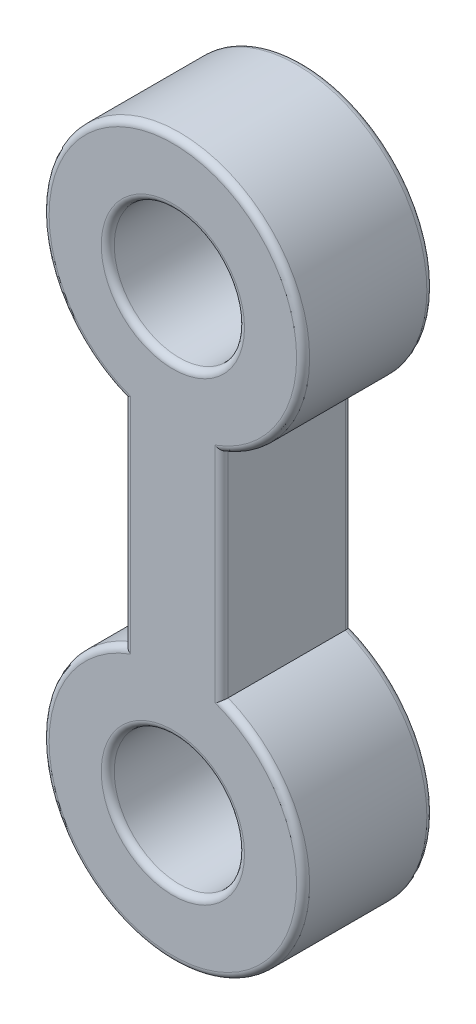
from build123d import *

# Parameters (mm, degrees)
SKETCH1_R           = 10
BOSS_EXTRUDE1_DEPTH = 10
FILLET1_R           = 1


with BuildPart() as part:
    # Sketch1 → Boss-Extrude1 (new, symmetric)
    with BuildSketch(Plane.XY):
        with BuildLine():
            Line((-7.5, -18.540496218), (-7.5, -51.459503782))
            ThreePointArc((-7.5, -51.459503782), (0, -90), (7.5, -51.459503782))
            Line((7.5, -51.459503782), (7.5, -18.540496218))
            ThreePointArc((7.5, -18.540496218), (0, 20), (-7.5, -18.540496218))
        make_face()
        Circle(SKETCH1_R, mode=Mode.SUBTRACT)
        with Locations((0, -70)):
            Circle(SKETCH1_R, mode=Mode.SUBTRACT)
    extrude(amount=BOSS_EXTRUDE1_DEPTH, both=True)

    # Fillet1
    fillet1_edges = [part.edges().sort_by_distance(p)[0] for p in [
        (-10, 0, -10),
        (-10, 0, 10),
        (0, -90, 10),
        (-10, -70, -10),
        (-10, -70, 10),
        (7.5, -35, 10),
        (0, 20, 10),
        (7.5, -35, -10),
        (0, -90, -10),
        (-7.5, -35, -10),
        (0, 20, -10),
        (-7.5, -35, 10),
    ]]
    fillet(fillet1_edges, radius=FILLET1_R)


solid = part.part
